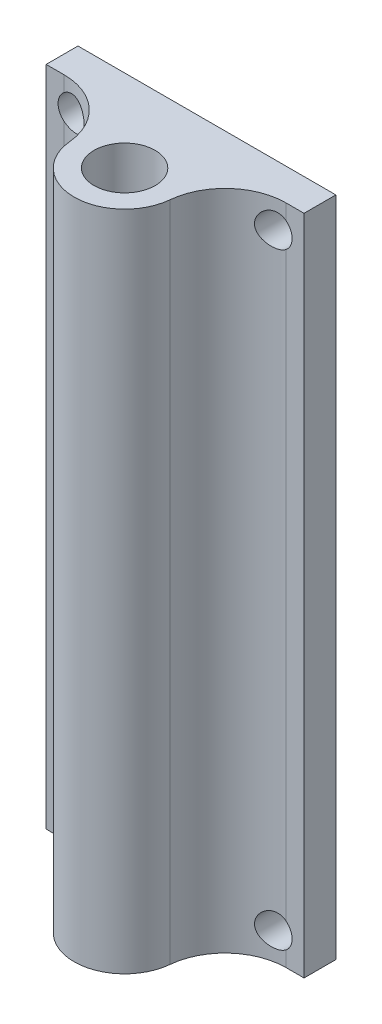
from build123d import *

# Parameters (mm, degrees)
SKETCH2_R               = 6.34
SKETCH2_R_2             = 3.84
BOSS_EXTRUDE1_DEPTH     = 83.2
FILLET1_R               = 7.68
CUT_EXTRUDE1_DEPTH      = 89.8622666
CUT_EXTRUDE1_DEPTH_BACK = 89.8622666
SKETCH3_R               = 2


with BuildPart() as part:
    # Sketch2 → Boss-Extrude1 (new body)
    # profile 1 of 2: a face of its own
    with BuildSketch(Plane(origin=(0, 0, 0), x_dir=(1, 0, 0), z_dir=(0, 1, 0))):
        with BuildLine():
            Line((16.2, 10.34), (-16.2, 10.34))
            Line((-16.2, 10.34), (-16.2, 6.34))
            Line((-16.2, 6.34), (-6.34, 6.34))
            Line((-6.34, 6.34), (-6.34, 0))
            ThreePointArc((-6.34, 0), (0, 6.34), (6.34, 0))
            Line((6.34, 0), (6.34, 6.34))
            Line((6.34, 6.34), (16.2, 6.34))
            Line((16.2, 6.34), (16.2, 10.34))
        make_face()
    # profile 2 of 2: a face of its own
    with BuildSketch(Plane(origin=(0, 0, 0), x_dir=(1, 0, 0), z_dir=(0, 1, 0))):
        Circle(SKETCH2_R)
        with Locations(Location((0, 0, 0), (0, 0, 270))):
            Circle(SKETCH2_R_2, mode=Mode.SUBTRACT)
    extrude(amount=BOSS_EXTRUDE1_DEPTH)

    # Fillet1
    fillet1_edges = [part.edges().sort_by_distance(p)[0] for p in [
        (-6.34, 41.6, -6.34),
        (6.34, 41.6, -6.34),
    ]]
    fillet(fillet1_edges, radius=FILLET1_R)

    # Sketch3 → Cut-Extrude1 (cut, two sides: drawn at the far end of the back side and taken through both)
    with BuildSketch(Plane(origin=(0, 0, -20.34), x_dir=(-1, 0, 0), z_dir=(0, 0, -1)).offset(-CUT_EXTRUDE1_DEPTH_BACK)):
        with Locations((12.7, 79.7)):
            Circle(SKETCH3_R)
        with Locations((12.7, 3.5)):
            Circle(SKETCH3_R)
        with Locations((-12.7, 3.5)):
            Circle(SKETCH3_R)
        with Locations((-12.7, 79.7)):
            Circle(SKETCH3_R)
    extrude(amount=CUT_EXTRUDE1_DEPTH + CUT_EXTRUDE1_DEPTH_BACK, mode=Mode.SUBTRACT)


solid = part.part
